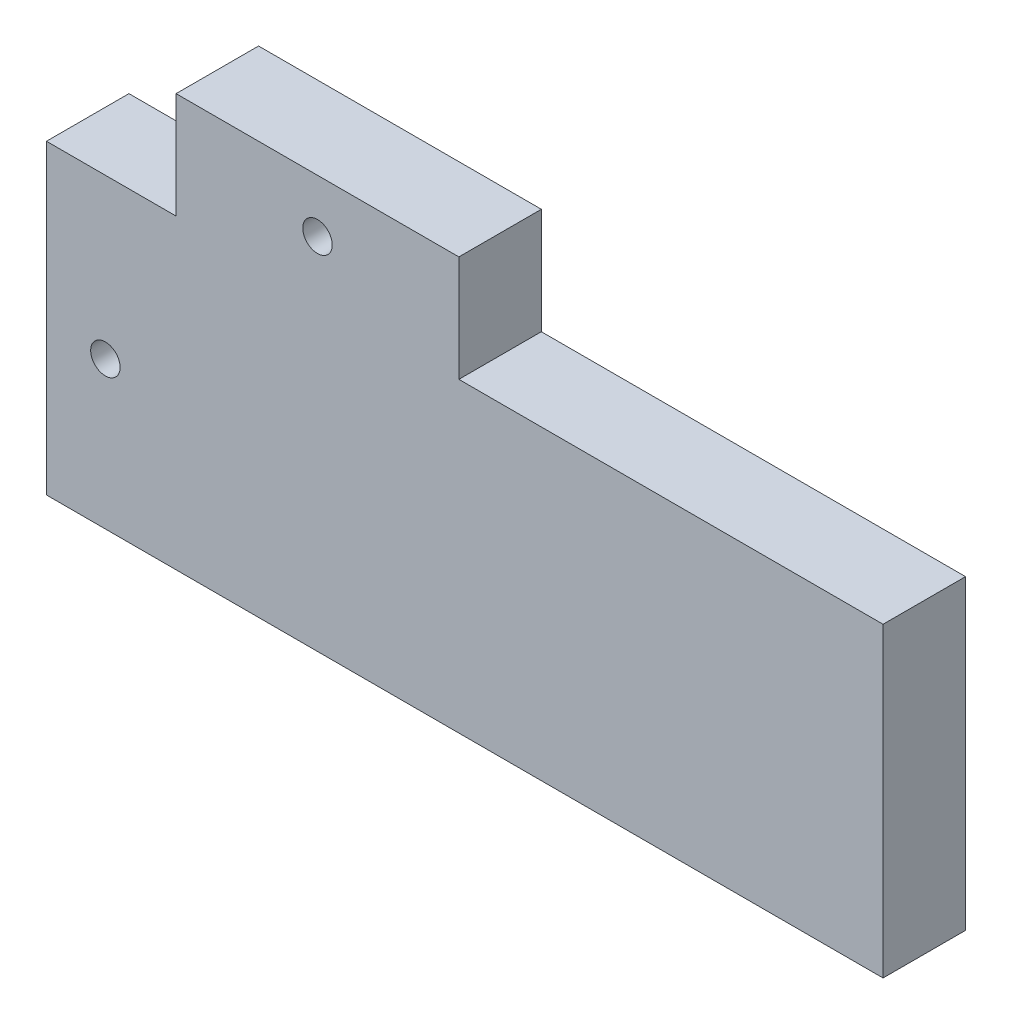
from build123d import *

# Parameters (mm, degrees)
SKETCH1_W           = 56
SKETCH1_H           = 26
SKETCH1_W_2         = 24
SKETCH1_H_2         = 9
BOSS_EXTRUDE1_DEPTH = 7
SKETCH2_R           = 1.25
CUT_EXTRUDE1_DEPTH  = 7
SKETCH3_R           = 2.65
CUT_EXTRUDE2_DEPTH  = 4.6
SKETCH4_W           = 7
SKETCH4_H           = 26
BOSS_EXTRUDE2_DEPTH = 15


with BuildPart() as part:
    # Sketch1 → Boss-Extrude1 (new body)
    with BuildSketch(Plane.XY):
        Rectangle(SKETCH1_W, SKETCH1_H)
        with Locations((-5, 17.5)):
            Rectangle(SKETCH1_W_2, SKETCH1_H_2)
    extrude(amount=BOSS_EXTRUDE1_DEPTH)

    # Sketch2 → Cut-Extrude1 (cut)
    with BuildSketch(Plane.XY.offset(7)):
        with Locations((-5, 17.5)):
            Circle(SKETCH2_R)
        with Locations((-23, -0.5)):
            Circle(SKETCH2_R)
    extrude(amount=-CUT_EXTRUDE1_DEPTH, mode=Mode.SUBTRACT)

    # Sketch3 → Cut-Extrude2 (cut)
    with BuildSketch(Plane(origin=(0, 0, 0), x_dir=(-1, 0, 0), z_dir=(0, 0, -1))):
        with Locations((-5.25, 7.25)):
            Circle(SKETCH3_R)
        with Locations((-19.25, 7.25)):
            Circle(SKETCH3_R)
    extrude(amount=-CUT_EXTRUDE2_DEPTH, mode=Mode.SUBTRACT)

    # Sketch4 → Boss-Extrude2 (add)
    with BuildSketch(Plane(origin=(28, 0, 0), x_dir=(0, 0, -1), z_dir=(1, 0, 0))):
        with Locations((-3.5, 0)):
            Rectangle(SKETCH4_W, SKETCH4_H)
    extrude(amount=BOSS_EXTRUDE2_DEPTH)


solid = part.part
